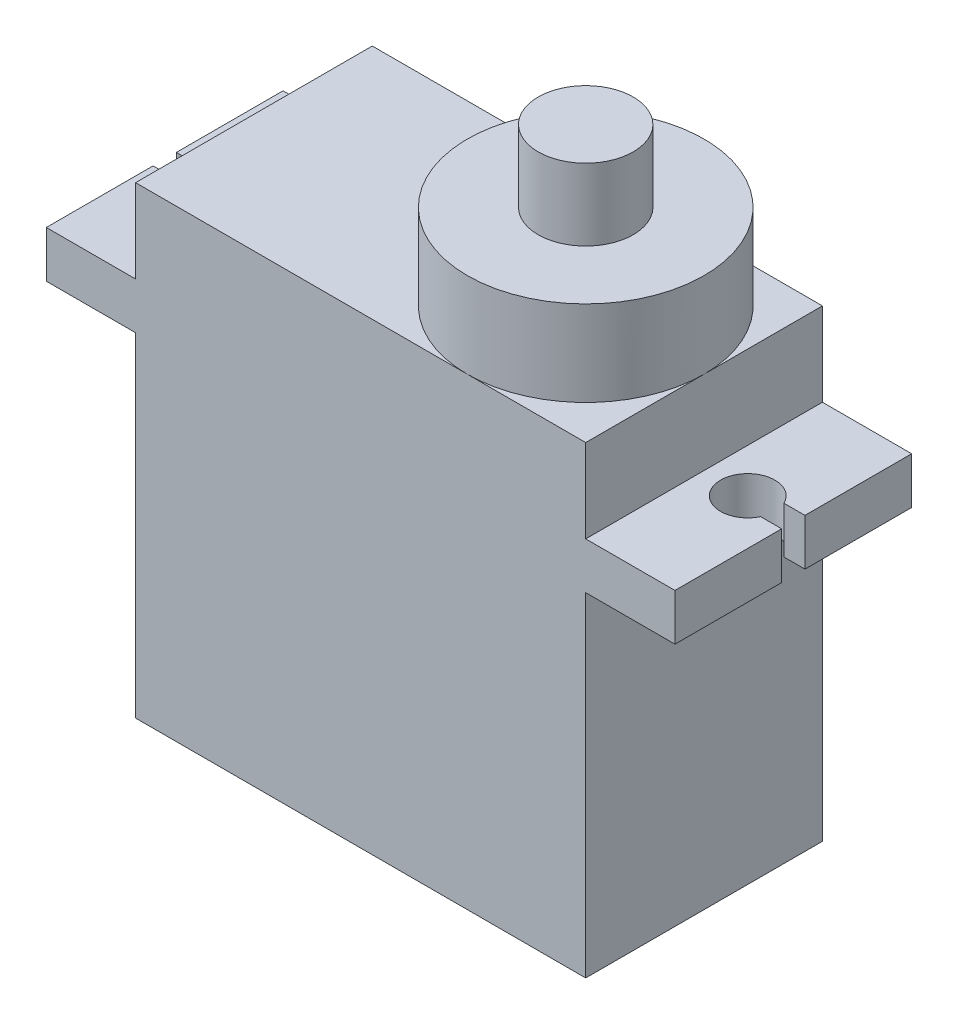
from build123d import *

# Parameters (mm, degrees)
SKETCH1_W           = 23.2
SKETCH1_H           = 17.2
BOSS_EXTRUDE1_DEPTH = 12.2
SKETCH2_W           = 32.4
SKETCH2_H           = 12.2
BOSS_EXTRUDE2_DEPTH = 2.4
CUT_EXTRUDE2_DEPTH  = 2.4
SKETCH4_W           = 23.2
SKETCH4_H           = 12.2
BOSS_EXTRUDE3_DEPTH = 4.3
SKETCH5_R           = 6.1
BOSS_EXTRUDE4_DEPTH = 4.4
SKETCH6_R           = 2.45
BOSS_EXTRUDE5_DEPTH = 3.7


with BuildPart() as part:
    # Sketch1 → Boss-Extrude1 (new body)
    with BuildSketch(Plane.XY):
        with Locations((7.517447917, 2.45234375)):
            Rectangle(SKETCH1_W, SKETCH1_H)
    extrude(amount=BOSS_EXTRUDE1_DEPTH)

    # Sketch2 → Boss-Extrude2 (add)
    with BuildSketch(Plane(origin=(0, 11.05234375, 0), x_dir=(1, 0, 0), z_dir=(0, 1, 0))):
        with Locations((7.517447917, -6.1)):
            Rectangle(SKETCH2_W, SKETCH2_H)
    extrude(amount=BOSS_EXTRUDE2_DEPTH)

    # Sketch3 → Cut-Extrude2 (cut)
    with BuildSketch(Plane(origin=(0, 13.45234375, 0), x_dir=(1, 0, 0), z_dir=(0, 1, 0))):
        with BuildLine():
            Line((22.632358981, -6.7), (23.914443448, -6.7))
            Line((23.914443448, -6.7), (23.914443448, -5.5))
            Line((23.914443448, -5.5), (22.632358981, -5.5))
            ThreePointArc((22.632358981, -5.5), (19.967447917, -6.1), (22.632358981, -6.7))
        make_face()
        with BuildLine():
            Line((-8.879547614, -5.5), (-7.597463147, -5.5))
            ThreePointArc((-7.597463147, -5.5), (-4.932552083, -6.1), (-7.597463147, -6.7))
            Line((-7.597463147, -6.7), (-8.879547614, -6.7))
            Line((-8.879547614, -6.7), (-8.879547614, -5.5))
        make_face()
    extrude(amount=-CUT_EXTRUDE2_DEPTH, mode=Mode.SUBTRACT)

    # Sketch4 → Boss-Extrude3 (add)
    with BuildSketch(Plane(origin=(0, 13.45234375, 0), x_dir=(1, 0, 0), z_dir=(0, 1, 0))):
        with Locations((7.517447917, -6.1)):
            Rectangle(SKETCH4_W, SKETCH4_H)
    extrude(amount=BOSS_EXTRUDE3_DEPTH)

    # Sketch5 → Boss-Extrude4 (add)
    with BuildSketch(Plane(origin=(0, 17.75234375, 0), x_dir=(1, 0, 0), z_dir=(0, 1, 0))):
        with Locations(Location((13.017447917, -6.1, 0), (0, 0, 270))):
            Circle(SKETCH5_R)
    extrude(amount=BOSS_EXTRUDE4_DEPTH)

    # Sketch6 → Boss-Extrude5 (add)
    with BuildSketch(Plane(origin=(0, 22.15234375, 0), x_dir=(1, 0, 0), z_dir=(0, 1, 0))):
        with Locations(Location((13.017447917, -6.1, 0), (0, 0, 270))):
            Circle(SKETCH6_R)
    extrude(amount=BOSS_EXTRUDE5_DEPTH)


solid = part.part
